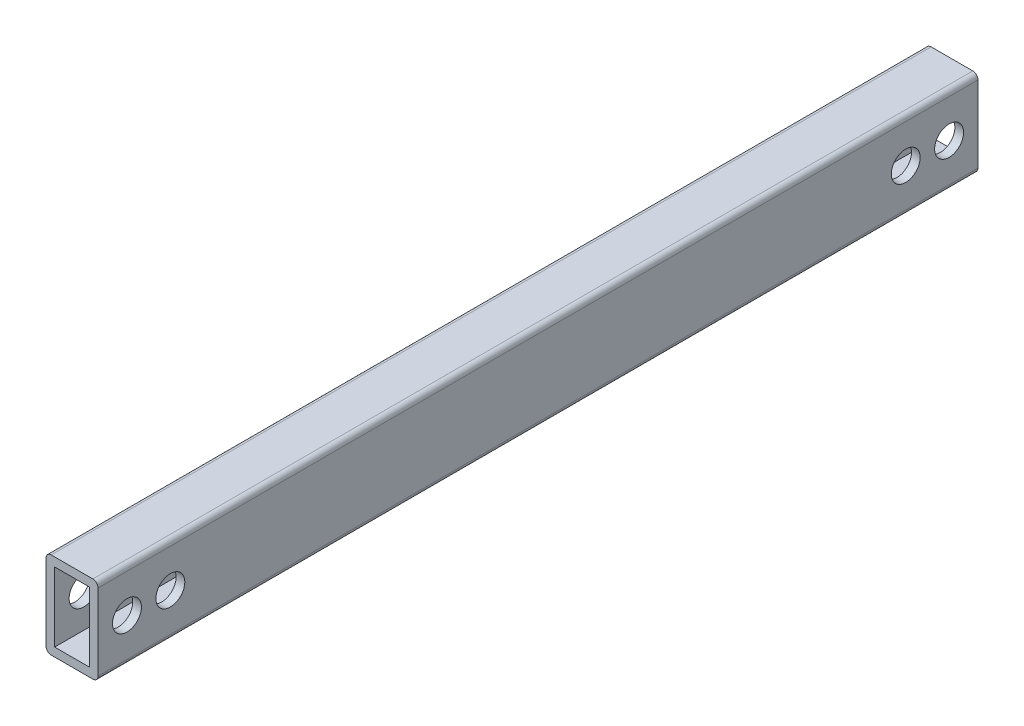
from build123d import *

# Parameters (mm, degrees)
SKETCH1_W         = 18
SKETCH1_H         = 30
SKETCH1_W_2       = 12
SKETCH1_H_2       = 24
BODY_DEPTH        = 304.31790468
SKETCH2_R         = 5
MOUNT_HOLES_DEPTH = 306.218589062
CORNER_FILLETS_R  = 1.8


with BuildPart() as part:
    # Sketch1 → Body (new body)
    with BuildSketch(Plane.XY):
        Rectangle(SKETCH1_W, SKETCH1_H)
        Rectangle(SKETCH1_W_2, SKETCH1_H_2, mode=Mode.SUBTRACT)
    extrude(amount=BODY_DEPTH)

    # Sketch2 → Mount Holes (cut, through all)
    with BuildSketch(Plane(origin=(9, 0, 0), x_dir=(0, 0, -1), z_dir=(1, 0, 0))):
        with Locations((-294.31790468, 0)):
            Circle(SKETCH2_R)
        with Locations((-279.31790468, 0)):
            Circle(SKETCH2_R)
        with Locations(Location((-25, 0, 0), (0, 0, 180))):
            Circle(SKETCH2_R)
        with Locations(Location((-10, 0, 0), (0, 0, 180))):
            Circle(SKETCH2_R)
    extrude(amount=-MOUNT_HOLES_DEPTH, mode=Mode.SUBTRACT)

    # Corner Fillets
    corner_fillets_edges = [part.edges().sort_by_distance(p)[0] for p in [
        (-9, 15, 152.15895234),
        (9, 15, 152.15895234),
        (9, -15, 152.15895234),
        (-9, -15, 152.15895234),
    ]]
    fillet(corner_fillets_edges, radius=CORNER_FILLETS_R)


solid = part.part
